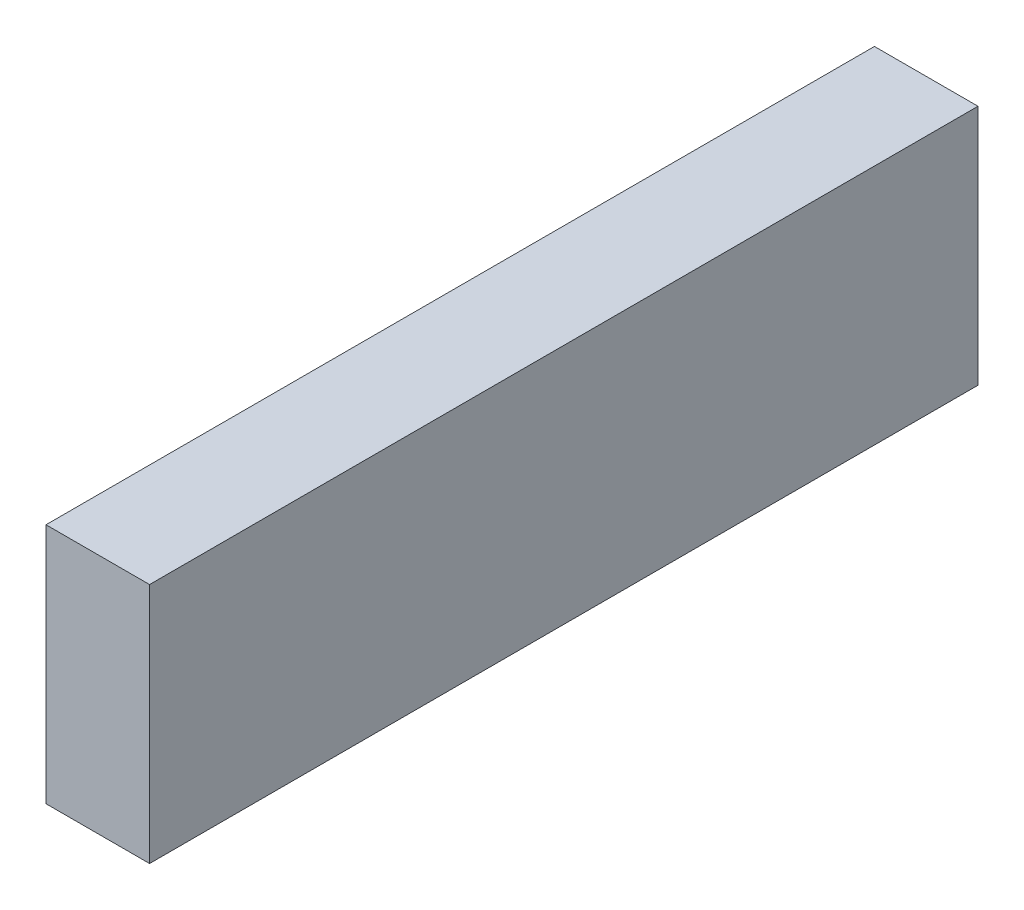
from build123d import *

# Parameters (mm, degrees)
SKETCH1_W           = 38.1
SKETCH1_H           = 88.9
BOSS_EXTRUDE1_DEPTH = 304.8


with BuildPart() as part:
    # Sketch1 → Boss-Extrude1 (new body)
    with BuildSketch(Plane.XY):
        with Locations((19.05, 44.45)):
            Rectangle(SKETCH1_W, SKETCH1_H)
    extrude(amount=BOSS_EXTRUDE1_DEPTH)


solid = part.part
